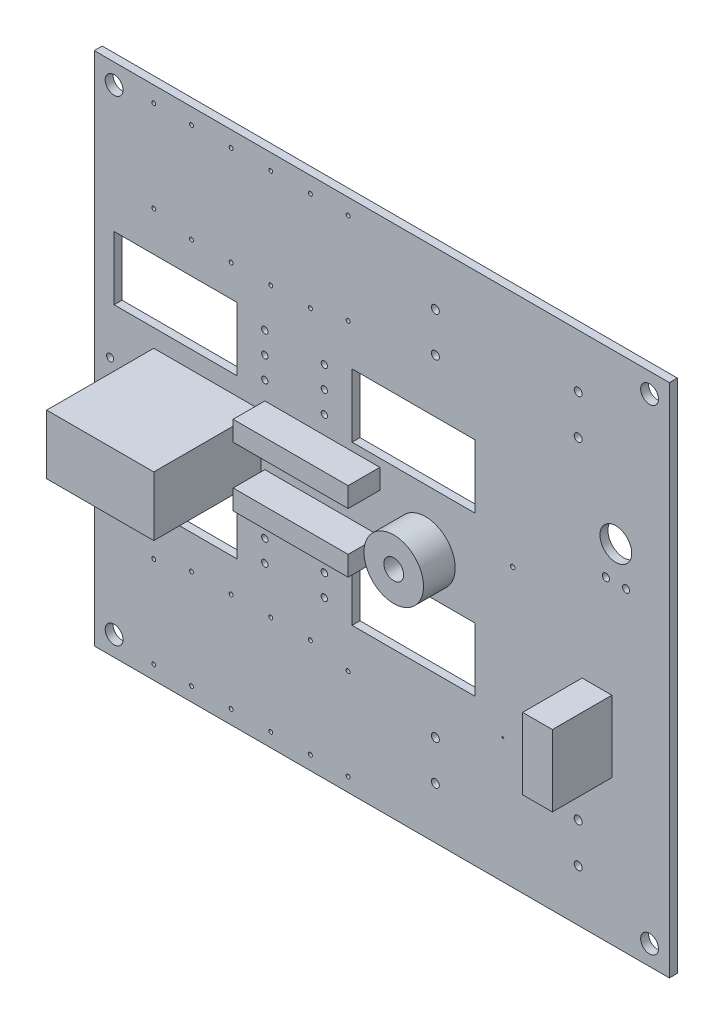
from build123d import *

# Parameters (mm, degrees)
SKETCH_1_W          = 145
SKETCH_1_H          = 130
SKETCH_1_R          = 2.25
SKETCH_1_W_2        = 31
SKETCH_1_H_2        = 16
EXTRUDE_1_DEPTH     = 2
SKETCH_2_R          = 0.5
SKETCH_2_R_2        = 0.8
CUT_EXTRUDE_1_DEPTH = 2
SKETCH_3_R          = 1
SKETCH_3_R_2        = 4
SKETCH_3_R_3        = 0.9
CUT_EXTRUDE_2_DEPTH = 2
SKETCH_4_R          = 7.5
SKETCH_4_R_2        = 2.5
SKETCH_4_W          = 29
SKETCH_4_H          = 5
EXTRUDE_2_DEPTH     = 8
SKETCH_5_R          = 0.55
SKETCH_5_R_2        = 0.25
CUT_EXTRUDE_3_DEPTH = 10
SKETCH_6_W          = 27
SKETCH_6_H          = 15
SKETCH_6_W_2        = 7.5
SKETCH_6_H_2        = 18
EXTRUDE_3_DEPTH     = 15
SKETCH_7_W          = 27
SKETCH_7_H          = 15
EXTRUDE_4_DEPTH     = 12
SKETCH_9_R          = 0.3
EXTRUDE_5_DEPTH     = 6.5
EXTRUDE_6_DEPTH     = 0.5
SKETCH_11_R         = 2.45
EXTRUDE_7_DEPTH     = 8.5
CHAMFER_1_SIZE      = 0.5
CHAMFER_1_SIZE2     = 0.08816349


with BuildPart() as part:
    # Эскиз1 → Вытянуть1 (new body)
    with BuildSketch(Plane.XY):
        Rectangle(SKETCH_1_W, SKETCH_1_H)
        with Locations((-67.5, 60)):
            Circle(SKETCH_1_R, mode=Mode.SUBTRACT)
        with Locations((-67.5, -60)):
            Circle(SKETCH_1_R, mode=Mode.SUBTRACT)
        with Locations((67.5, 60)):
            Circle(SKETCH_1_R, mode=Mode.SUBTRACT)
        with Locations((67.5, -60)):
            Circle(SKETCH_1_R, mode=Mode.SUBTRACT)
        with Locations((-52, 20)):
            Rectangle(SKETCH_1_W_2, SKETCH_1_H_2, mode=Mode.SUBTRACT)
        with Locations((-52, -20)):
            Rectangle(SKETCH_1_W_2, SKETCH_1_H_2, mode=Mode.SUBTRACT)
        with Locations((8, 20)):
            Rectangle(SKETCH_1_W_2, SKETCH_1_H_2, mode=Mode.SUBTRACT)
        with Locations((8, -20)):
            Rectangle(SKETCH_1_W_2, SKETCH_1_H_2, mode=Mode.SUBTRACT)
    extrude(amount=EXTRUDE_1_DEPTH)

    # Эскиз2 → Вырез-Вытянуть1 (cut)
    with BuildSketch(Plane.XY.offset(2)):
        with Locations((-57.5, 61)):
            Circle(SKETCH_2_R)
        with Locations((-48, 61)):
            Circle(SKETCH_2_R)
        with Locations((-57.5, 38)):
            Circle(SKETCH_2_R)
        with Locations((-48, 36)):
            Circle(SKETCH_2_R)
        with Locations((-38, 61)):
            Circle(SKETCH_2_R)
        with Locations((-38, 36)):
            Circle(SKETCH_2_R)
        with Locations((-28, 61)):
            Circle(SKETCH_2_R)
        with Locations((-28, 36)):
            Circle(SKETCH_2_R)
        with Locations((-18, 61)):
            Circle(SKETCH_2_R)
        with Locations((-18, 36)):
            Circle(SKETCH_2_R)
        with Locations((-8.5, 61)):
            Circle(SKETCH_2_R)
        with Locations((-8.5, 38)):
            Circle(SKETCH_2_R)
        with Locations(Location((-8.5, -38.5, 0), (0, 0, 180))):
            Circle(SKETCH_2_R)
        with Locations(Location((-8.5, -61.5, 0), (0, 0, 180))):
            Circle(SKETCH_2_R)
        with Locations(Location((-18, -61.5, 0), (0, 0, 180))):
            Circle(SKETCH_2_R)
        with Locations(Location((-18, -36.5, 0), (0, 0, 180))):
            Circle(SKETCH_2_R)
        with Locations(Location((-28, -36.5, 0), (0, 0, 180))):
            Circle(SKETCH_2_R)
        with Locations(Location((-28, -61.5, 0), (0, 0, 180))):
            Circle(SKETCH_2_R)
        with Locations(Location((-38, -61.5, 0), (0, 0, 180))):
            Circle(SKETCH_2_R)
        with Locations(Location((-38, -36.5, 0), (0, 0, 180))):
            Circle(SKETCH_2_R)
        with Locations(Location((-48, -36.5, 0), (0, 0, 180))):
            Circle(SKETCH_2_R)
        with Locations(Location((-48, -61.5, 0), (0, 0, 180))):
            Circle(SKETCH_2_R)
        with Locations(Location((-57.5, -61.5, 0), (0, 0, 180))):
            Circle(SKETCH_2_R)
        with Locations(Location((-57.5, -38.5, 0), (0, 0, 180))):
            Circle(SKETCH_2_R)
        with Locations((-29.5, 20)):
            Circle(SKETCH_2_R_2)
        with Locations((-29.5, -20)):
            Circle(SKETCH_2_R_2)
        with Locations((-29.5, 14.55)):
            Circle(SKETCH_2_R_2)
        with Locations((-29.5, 25.45)):
            Circle(SKETCH_2_R_2)
        with Locations((-29.5, -14.55)):
            Circle(SKETCH_2_R_2)
        with Locations((-29.5, -25.45)):
            Circle(SKETCH_2_R_2)
        with Locations((-14.5, 20)):
            Circle(SKETCH_2_R_2)
        with Locations((-14.5, -20)):
            Circle(SKETCH_2_R_2)
        with Locations((-14.5, 14.55)):
            Circle(SKETCH_2_R_2)
        with Locations((-14.5, 25.45)):
            Circle(SKETCH_2_R_2)
        with Locations((-14.5, -14.866018045)):
            Circle(SKETCH_2_R_2)
        with Locations((-14.5, -25.45)):
            Circle(SKETCH_2_R_2)
    extrude(amount=-CUT_EXTRUDE_1_DEPTH, mode=Mode.SUBTRACT)

    # Эскиз3 → Вырез-Вытянуть2 (cut)
    with BuildSketch(Plane.XY.offset(2)):
        with Locations((13.5, 41.5)):
            Circle(SKETCH_3_R)
        with Locations((13.5, 51.5)):
            Circle(SKETCH_3_R)
        with Locations((49.5, 41.5)):
            Circle(SKETCH_3_R)
        with Locations((49.5, 51.5)):
            Circle(SKETCH_3_R)
        with Locations((13.5, -52)):
            Circle(SKETCH_3_R)
        with Locations((13.5, -42)):
            Circle(SKETCH_3_R)
        with Locations((49.5, -52)):
            Circle(SKETCH_3_R)
        with Locations((49.5, -42)):
            Circle(SKETCH_3_R)
        with Locations((59, 23)):
            Circle(SKETCH_3_R_2)
        with Locations((-68.5, 0)):
            Circle(SKETCH_3_R_3)
        with Locations((-63.42, 0)):
            Circle(SKETCH_3_R_3)
        with Locations((56.5, 14.5)):
            Circle(SKETCH_3_R_3)
        with Locations((61.58, 14.5)):
            Circle(SKETCH_3_R_3)
    extrude(amount=-CUT_EXTRUDE_2_DEPTH, mode=Mode.SUBTRACT)

    # Эскиз4 → Вытянуть2 (add)
    # profile 1 of 3: a face of its own
    with BuildSketch(Plane.XY.offset(2)):
        with Locations(Location((11, -2.5, 0), (0, 0, 180))):
            Circle(SKETCH_4_R)
        with Locations((11, -2.5)):
            Circle(SKETCH_4_R_2, mode=Mode.SUBTRACT)
    # profile 2 of 3: a face of its own
    with BuildSketch(Plane.XY.offset(2)):
        with Locations((-15, 7.5)):
            Rectangle(SKETCH_4_W, SKETCH_4_H)
    # profile 3 of 3: a face of its own
    with BuildSketch(Plane.XY.offset(2)):
        with Locations((-15, -7.5)):
            Rectangle(SKETCH_4_W, SKETCH_4_H)
    extrude(amount=EXTRUDE_2_DEPTH)

    # Эскиз5 → Вырез-Вытянуть3 (cut)
    with BuildSketch(Plane.XY.offset(2)):
        with Locations((33, 5)):
            Circle(SKETCH_5_R)
        with Locations((30.5, -33.5)):
            Circle(SKETCH_5_R_2)
    extrude(amount=-CUT_EXTRUDE_3_DEPTH, mode=Mode.SUBTRACT)

    # Эскиз6 → Вытянуть3 (add)
    with BuildSketch(Plane.XY.offset(2)):
        with Locations((-44, 0)):
            Rectangle(SKETCH_6_W, SKETCH_6_H)
        with Locations((54.25, -19.5)):
            Rectangle(SKETCH_6_W_2, SKETCH_6_H_2)
    extrude(amount=EXTRUDE_3_DEPTH)

    # Эскиз7 → Вытянуть4 (add)
    with BuildSketch(Plane.XY.offset(17)):
        with Locations((-44, 0)):
            Rectangle(SKETCH_7_W, SKETCH_7_H)
    extrude(amount=EXTRUDE_4_DEPTH)

    # Эскиз9 → Вытянуть5 (add)
    with BuildSketch(Plane.XY.offset(2)):
        with Locations((29.23, -32.6)):
            Circle(SKETCH_9_R)
        with Locations((31.77, -32.6)):
            Circle(SKETCH_9_R)
        with Locations((30.5, -34.7)):
            Circle(SKETCH_9_R)
    extrude(amount=-EXTRUDE_5_DEPTH)

    # Эскиз10 → Вытянуть6 (add)
    with BuildSketch(Plane(origin=(0, 0, -4.5), x_dir=(-1, 0, 0), z_dir=(0, 0, -1))):
        with BuildLine():
            Line((-31.84079253, -31.099005333), (-29.15920747, -31.099005333))
            ThreePointArc((-29.15920747, -31.099005333), (-30.5, -36.25), (-31.84079253, -31.099005333))
        make_face()
    extrude(amount=EXTRUDE_6_DEPTH)

    # Эскиз11 → Вытянуть7 (add)
    with BuildSketch(Plane(origin=(0, 0, -5), x_dir=(-1, 0, 0), z_dir=(0, 0, -1))):
        with Locations(Location((-30.5, -33.5, 0), (0, 0, 101.478967652))):
            Circle(SKETCH_11_R)
    extrude(amount=EXTRUDE_7_DEPTH)

    # Фаска1
    chamfer_1_edges = [part.edges().sort_by_distance(p)[0] for p in [
        (30.012429894, -35.900994667, -13.5),
    ]]
    chamfer_1_side = [part.faces().sort_by_distance(p)[0] for p in [
        (30.012429894, -35.900994667, -9.25),
    ]]
    chamfer(chamfer_1_edges, length=CHAMFER_1_SIZE, length2=CHAMFER_1_SIZE2, reference=chamfer_1_side[0])


solid = part.part
